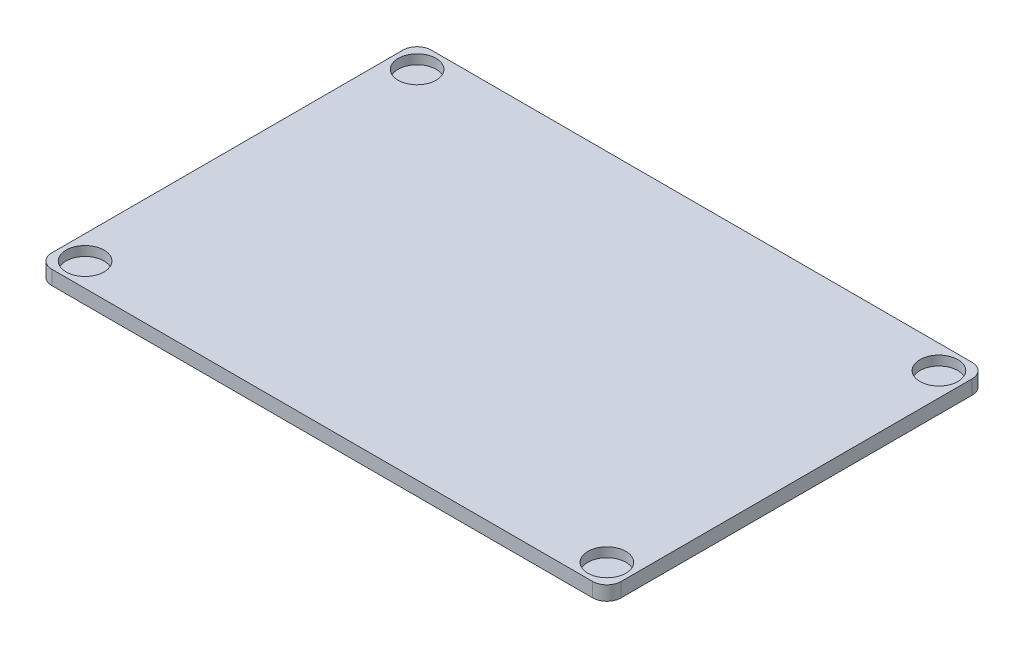
from build123d import *

# Parameters (mm, degrees)
SKETCH1_W               = 120
SKETCH1_H               = 80
BOSS_EXTRUDE1_DEPTH     = 3
SKETCH2_R               = 4
CUT_EXTRUDE1_DEPTH      = 2
MIRROR2_COPY_1_SKETCH_R = 4
MIRROR2_COPY_1_DEPTH    = 2
FILLET2_R               = 3


with BuildPart() as part:
    # Sketch1 → Boss-Extrude1 (new body)
    with BuildSketch(Plane(origin=(0, 0, 0), x_dir=(1, 0, 0), z_dir=(0, 1, 0))):
        with Locations((60, 40)):
            Rectangle(SKETCH1_W, SKETCH1_H)
    extrude(amount=BOSS_EXTRUDE1_DEPTH)

    # Sketch2 → Cut-Extrude1 (cut)
    with BuildSketch(Plane(origin=(0, 3, 0), x_dir=(1, 0, 0), z_dir=(0, 1, 0))):
        with Locations(Location((5, 75, 0), (0, 0, 270))):
            Circle(SKETCH2_R)
    cut_extrude1 = extrude(amount=-CUT_EXTRUDE1_DEPTH, mode=Mode.SUBTRACT)

    # Mirror1: Cut-Extrude1 across plane
    add(cut_extrude1.mirror(Plane(origin=(0, 0, -40), x_dir=(1, 0, 0), z_dir=(0, 0, -1))), mode=Mode.SUBTRACT)

    # Mirror2: Cut-Extrude1 across plane
    add(cut_extrude1.mirror(Plane.ZY.offset(-60)), mode=Mode.SUBTRACT)

    # Mirror2 copy 1 sketch → Mirror2 copy 1 (cut)
    with BuildSketch(Plane(origin=(120, 3, -80), x_dir=(-1, 0, 0), z_dir=(0, 1, 0))):
        with Locations(Location((5, 75, 0), (0, 0, 270))):
            Circle(MIRROR2_COPY_1_SKETCH_R)
    extrude(amount=-MIRROR2_COPY_1_DEPTH, mode=Mode.SUBTRACT)

    # Fillet2
    fillet2_edges = [part.edges().sort_by_distance(p)[0] for p in [
        (0, 1.5, -80),
        (120, 1.5, -80),
        (120, 1.5, 0),
        (0, 1.5, 0),
    ]]
    fillet(fillet2_edges, radius=FILLET2_R)


solid = part.part
